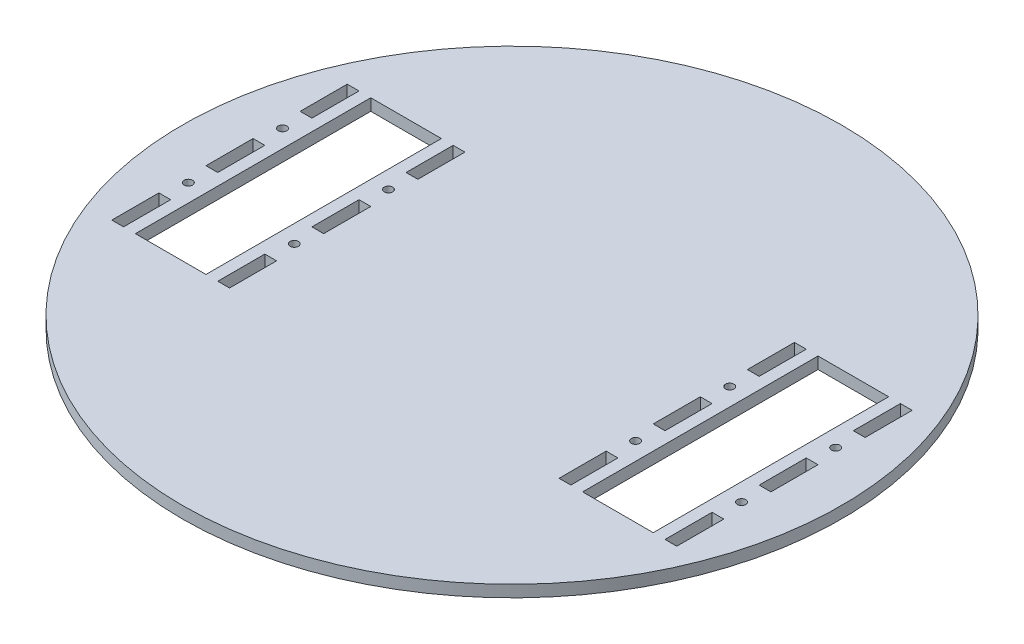
from build123d import *

# Parameters (mm, degrees)
SKETCH1_R           = 177.8
BOSS_EXTRUDE1_DEPTH = 6.35
SKETCH2_R           = 2.286
SKETCH2_W           = 38.1
SKETCH2_H           = 127
SKETCH2_W_2         = 6.35
SKETCH2_H_2         = 25.4
CUT_EXTRUDE1_DEPTH  = 252.527339468


with BuildPart() as part:
    # Sketch1 → Boss-Extrude1 (new body)
    with BuildSketch(Plane(origin=(0, 0, 0), x_dir=(1, 0, 0), z_dir=(0, 1, 0))):
        with Locations(Location((0, 0, 0), (0, 0, 270))):
            Circle(SKETCH1_R)
    extrude(amount=BOSS_EXTRUDE1_DEPTH)

    # Sketch2 → Cut-Extrude1 (cut, through all)
    with BuildSketch(Plane(origin=(0, 6.35, 0), x_dir=(1, 0, 0), z_dir=(0, 1, 0))):
        with Locations(Location((-149.225, 25.4, 0), (0, 0, 270))):
            Circle(SKETCH2_R)
        with Locations(Location((-149.225, -25.4, 0), (0, 0, 90))):
            Circle(SKETCH2_R)
        with Locations(Location((-92.075, -25.4, 0), (0, 0, 270))):
            Circle(SKETCH2_R)
        with Locations(Location((-92.075, 25.4, 0), (0, 0, 90))):
            Circle(SKETCH2_R)
        with Locations(Location((92.075, 25.4, 0), (0, 0, 270))):
            Circle(SKETCH2_R)
        with Locations(Location((92.075, -25.4, 0), (0, 0, 90))):
            Circle(SKETCH2_R)
        with Locations(Location((149.225, -25.4, 0), (0, 0, 270))):
            Circle(SKETCH2_R)
        with Locations(Location((149.225, 25.4, 0), (0, 0, 90))):
            Circle(SKETCH2_R)
        with Locations((-120.65, 0)):
            Rectangle(SKETCH2_W, SKETCH2_H)
        with Locations((-149.225, 50.8)):
            Rectangle(SKETCH2_W_2, SKETCH2_H_2)
        with Locations((-149.225, 0)):
            Rectangle(SKETCH2_W_2, SKETCH2_H_2)
        with Locations((-149.225, -50.8)):
            Rectangle(SKETCH2_W_2, SKETCH2_H_2)
        with Locations((-92.075, -50.8)):
            Rectangle(SKETCH2_W_2, SKETCH2_H_2)
        with Locations((-92.075, 0)):
            Rectangle(SKETCH2_W_2, SKETCH2_H_2)
        with Locations((-92.075, 50.8)):
            Rectangle(SKETCH2_W_2, SKETCH2_H_2)
        with Locations((92.075, 50.8)):
            Rectangle(SKETCH2_W_2, SKETCH2_H_2)
        with Locations((92.075, 0)):
            Rectangle(SKETCH2_W_2, SKETCH2_H_2)
        with Locations((92.075, -50.8)):
            Rectangle(SKETCH2_W_2, SKETCH2_H_2)
        with Locations((149.225, -50.8)):
            Rectangle(SKETCH2_W_2, SKETCH2_H_2)
        with Locations((149.225, 0)):
            Rectangle(SKETCH2_W_2, SKETCH2_H_2)
        with Locations((149.225, 50.8)):
            Rectangle(SKETCH2_W_2, SKETCH2_H_2)
        with Locations((120.65, 0)):
            Rectangle(SKETCH2_W, SKETCH2_H)
    extrude(amount=-CUT_EXTRUDE1_DEPTH, mode=Mode.SUBTRACT)


solid = part.part
